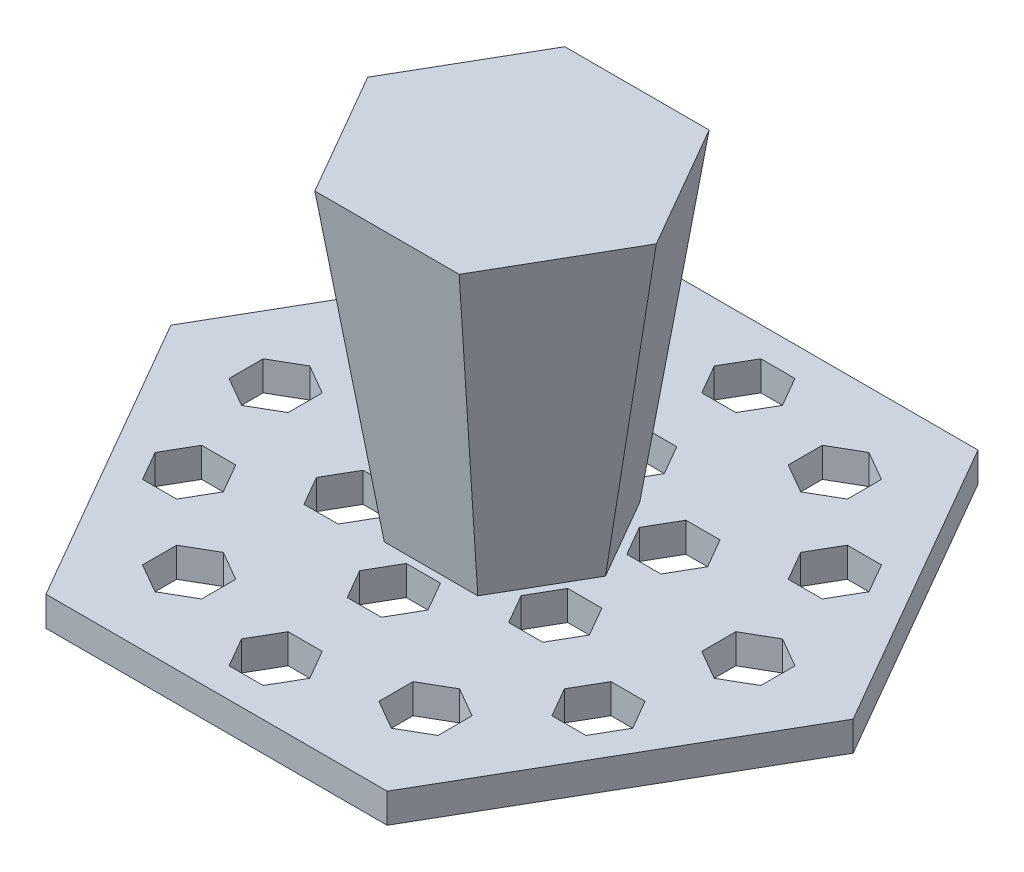
from build123d import *

# Parameters (mm, degrees)
BOSS_EXTRUDE1_DEPTH = 5
BOSS_EXTRUDE2_DEPTH = 58
BOSS_EXTRUDE2_DRAFT = -8


with BuildPart() as part:
    # Sketch1 → Boss-Extrude1 (new body)
    with BuildSketch(Plane(origin=(0, 0, 0), x_dir=(1, 0, 0), z_dir=(0, 1, 0))):
        Polygon((38.97114317, 32.5), (28.867513459, 50), (8.660254038, 50), (-8.660254038, 50), (-28.867513459, 50), (-38.97114317, 32.5), (-47.631397208, 17.5), (-57.735026919, 0), (-47.631397208, -17.5), (-38.97114317, -32.5), (-28.867513459, -50), (-8.660254038, -50), (8.660254038, -50), (28.867513459, -50), (38.97114317, -32.5), (47.631397208, -17.5), (57.735026919, 0), (47.631397208, 17.5), align=None)
        Polygon((-20, -40.414518843), (-25, -37.527767497), (-25, -31.754264805), (-20, -28.867513459), (-15, -31.754264805), (-15, -37.527767497), align=None, mode=Mode.SUBTRACT)
        Polygon((2.886751346, -45), (-2.886751346, -45), (-5.773502692, -40), (-2.886751346, -35), (2.886751346, -35), (5.773502692, -40), align=None, mode=Mode.SUBTRACT)
        Polygon((-37.527767497, -25), (-40.414518843, -20), (-37.527767497, -15), (-31.754264805, -15), (-28.867513459, -20), (-31.754264805, -25), align=None, mode=Mode.SUBTRACT)
        Polygon((-2.886751346, -25), (-5.773502692, -20), (-2.886751346, -15), (2.886751346, -15), (5.773502692, -20), (2.886751346, -25), align=None, mode=Mode.SUBTRACT)
        Polygon((-23.094010768, -10), (-20.207259422, -5), (-14.43375673, -5), (-11.547005384, -10), (-14.43375673, -15), (-20.207259422, -15), align=None, mode=Mode.SUBTRACT)
        Polygon((25, -37.527767497), (20, -40.414518843), (15, -37.527767497), (15, -31.754264805), (20, -28.867513459), (25, -31.754264805), align=None, mode=Mode.SUBTRACT)
        Polygon((40.414518843, -20), (37.527767497, -25), (31.754264805, -25), (28.867513459, -20), (31.754264805, -15), (37.527767497, -15), align=None, mode=Mode.SUBTRACT)
        Polygon((20.207259422, -15), (14.43375673, -15), (11.547005384, -10), (14.43375673, -5), (20.207259422, -5), (23.094010768, -10), align=None, mode=Mode.SUBTRACT)
        Polygon((45, 2.886751346), (45, -2.886751346), (40, -5.773502692), (35, -2.886751346), (35, 2.886751346), (40, 5.773502692), align=None, mode=Mode.SUBTRACT)
        Polygon((-45, -2.886751346), (-45, 2.886751346), (-40, 5.773502692), (-35, 2.886751346), (-35, -2.886751346), (-40, -5.773502692), align=None, mode=Mode.SUBTRACT)
        Polygon((-20.207259422, 15), (-14.43375673, 15), (-11.547005384, 10), (-14.43375673, 5), (-20.207259422, 5), (-23.094010768, 10), align=None, mode=Mode.SUBTRACT)
        Polygon((-40.414518843, 20), (-37.527767497, 25), (-31.754264805, 25), (-28.867513459, 20), (-31.754264805, 15), (-37.527767497, 15), align=None, mode=Mode.SUBTRACT)
        Polygon((-25, 37.527767497), (-20, 40.414518843), (-15, 37.527767497), (-15, 31.754264805), (-20, 28.867513459), (-25, 31.754264805), align=None, mode=Mode.SUBTRACT)
        Polygon((23.094010768, 10), (20.207259422, 5), (14.43375673, 5), (11.547005384, 10), (14.43375673, 15), (20.207259422, 15), align=None, mode=Mode.SUBTRACT)
        Polygon((37.527767497, 25), (40.414518843, 20), (37.527767497, 15), (31.754264805, 15), (28.867513459, 20), (31.754264805, 25), align=None, mode=Mode.SUBTRACT)
        Polygon((2.886751346, 25), (5.773502692, 20), (2.886751346, 15), (-2.886751346, 15), (-5.773502692, 20), (-2.886751346, 25), align=None, mode=Mode.SUBTRACT)
        Polygon((20, 40.414518843), (25, 37.527767497), (25, 31.754264805), (20, 28.867513459), (15, 31.754264805), (15, 37.527767497), align=None, mode=Mode.SUBTRACT)
        Polygon((-2.886751346, 45), (2.886751346, 45), (5.773502692, 40), (2.886751346, 35), (-2.886751346, 35), (-5.773502692, 40), align=None, mode=Mode.SUBTRACT)
    extrude(amount=BOSS_EXTRUDE1_DEPTH)


with BuildPart() as boss_extrude2_tool:
    # Sketch2 → Boss-Extrude2 (with draft: the straight prism first)
    with BuildSketch(Plane(origin=(0, 0, 0), x_dir=(1, 0, 0), z_dir=(0, 1, 0))):
        Polygon((7.505553499, -13), (15.011106999, 0), (7.505553499, 13), (-7.505553499, 13), (-15.011106999, 0), (-7.505553499, -13), align=None)
    extrude(amount=BOSS_EXTRUDE2_DEPTH)
    # Boss-Extrude2: the draft: its side faces are tilted about the plane it starts from
    boss_extrude2_sides = [boss_extrude2_tool.faces().sort_by_distance(p)[0] for p in [
        (11.258330249, 29, 6.5),
        (11.258330249, 29, -6.5),
        (0, 29, -13),
        (-11.258330249, 29, -6.5),
        (-11.258330249, 29, 6.5),
        (0, 29, 13),
    ]]
    draft(boss_extrude2_sides, Plane(origin=(0, 0, 0), x_dir=(1, 0, 0), z_dir=(0, 1, 0)), BOSS_EXTRUDE2_DRAFT)


with BuildPart() as part_1:
    add(part.part)

    # Boss-Extrude2: add boss_extrude2_tool
    add(boss_extrude2_tool.part)


solid = part_1.part
